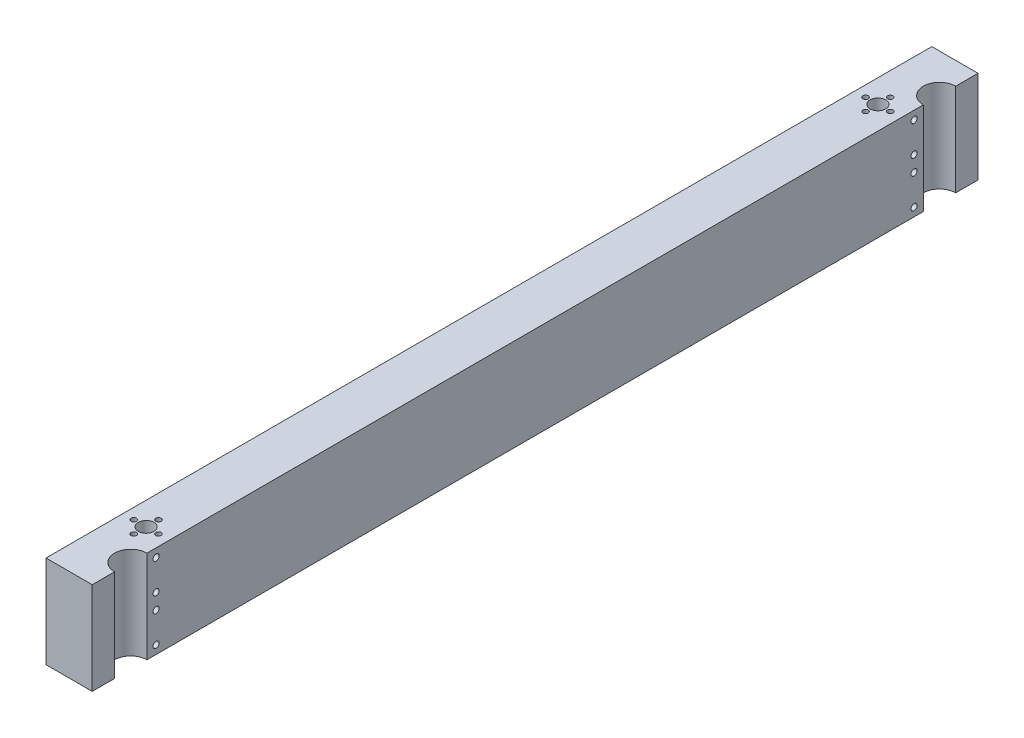
from build123d import *

# Parameters (mm, degrees)
SKETCH1_W               = 30
SKETCH1_H               = 60
BOSS_EXTRUDE1_DEPTH     = 287.5
SKETCH2_R               = 10.5
CUT_EXTRUDE1_DEPTH      = 295.076945713
SKETCH3_R               = 5.1
CUT_EXTRUDE2_DEPTH      = 10
SKETCH4_R               = 4
SKETCH4_R_2             = 1.75
CUT_EXTRUDE3_DEPTH      = 295.076945713
SKETCH5_R               = 2
CUT_EXTRUDE4_DEPTH      = 7
MIRROR1_COPY_1_SKETCH_R = 5.1
MIRROR1_COPY_1_DEPTH    = 10


with BuildPart() as part:
    # Sketch1 → Boss-Extrude1 (new, symmetric)
    with BuildSketch(Plane.XY):
        Rectangle(SKETCH1_W, SKETCH1_H)
    extrude(amount=BOSS_EXTRUDE1_DEPTH, both=True)

    # Sketch2 → Cut-Extrude1 (cut, through all)
    with BuildSketch(Plane(origin=(0, 30, 0), x_dir=(1, 0, 0), z_dir=(0, 1, 0))):
        with Locations((15, -262.5)):
            Circle(SKETCH2_R)
    cut_extrude1 = extrude(amount=-CUT_EXTRUDE1_DEPTH, mode=Mode.SUBTRACT)

    # Sketch3 → Cut-Extrude2 (cut)
    with BuildSketch(Plane(origin=(0, 30, 0), x_dir=(1, 0, 0), z_dir=(0, 1, 0))):
        with Locations(Location((0, -237.5, 0), (0, 0, 270))):
            Circle(SKETCH3_R)
    cut_extrude2 = extrude(amount=-CUT_EXTRUDE2_DEPTH, mode=Mode.SUBTRACT)

    # Mirror2: Cut-Extrude2 across plane
    add(cut_extrude2.mirror(Plane.ZX), mode=Mode.SUBTRACT)

    # Sketch4 → Cut-Extrude3 (cut, through all)
    with BuildSketch(Plane(origin=(0, 30, 0), x_dir=(1, 0, 0), z_dir=(0, 1, 0))):
        with Locations(Location((0, -237.5, 0), (0, 0, 270))):
            Circle(SKETCH4_R)
        with Locations(Location((-8, -237.5, 0), (0, 0, 270))):
            Circle(SKETCH4_R_2)
        with Locations(Location((0, -229.5, 0), (0, 0, 270))):
            Circle(SKETCH4_R_2)
        with Locations(Location((8, -237.5, 0), (0, 0, 270))):
            Circle(SKETCH4_R_2)
        with Locations(Location((0, -245.5, 0), (0, 0, 270))):
            Circle(SKETCH4_R_2)
    cut_extrude3 = extrude(amount=-CUT_EXTRUDE3_DEPTH, mode=Mode.SUBTRACT)

    # Sketch5 → Cut-Extrude4 (cut)
    with BuildSketch(Plane(origin=(15, 0, 0), x_dir=(0, 0, -1), z_dir=(1, 0, 0))):
        with Locations((-246, 24.5)):
            Circle(SKETCH5_R)
        with Locations((-246, 5)):
            Circle(SKETCH5_R)
        with Locations(Location((-246, -5, 0), (0, 0, 180))):
            Circle(SKETCH5_R)
        with Locations(Location((-246, -24.5, 0), (0, 0, 180))):
            Circle(SKETCH5_R)
    cut_extrude4 = extrude(amount=-CUT_EXTRUDE4_DEPTH, mode=Mode.SUBTRACT)

    # Mirror1: Cut-Extrude1, Cut-Extrude2, Cut-Extrude3, Cut-Extrude4 across plane
    add(cut_extrude1.mirror(Plane.XY), mode=Mode.SUBTRACT)
    add(cut_extrude2.mirror(Plane.XY), mode=Mode.SUBTRACT)
    add(cut_extrude3.mirror(Plane.XY), mode=Mode.SUBTRACT)
    add(cut_extrude4.mirror(Plane.XY), mode=Mode.SUBTRACT)

    # Mirror1 copy 1 sketch → Mirror1 copy 1 (cut)
    with BuildSketch(Plane.XZ.offset(30)):
        with Locations(Location((0, -237.5, 0), (0, 0, 270))):
            Circle(MIRROR1_COPY_1_SKETCH_R)
    extrude(amount=-MIRROR1_COPY_1_DEPTH, mode=Mode.SUBTRACT)


solid = part.part
